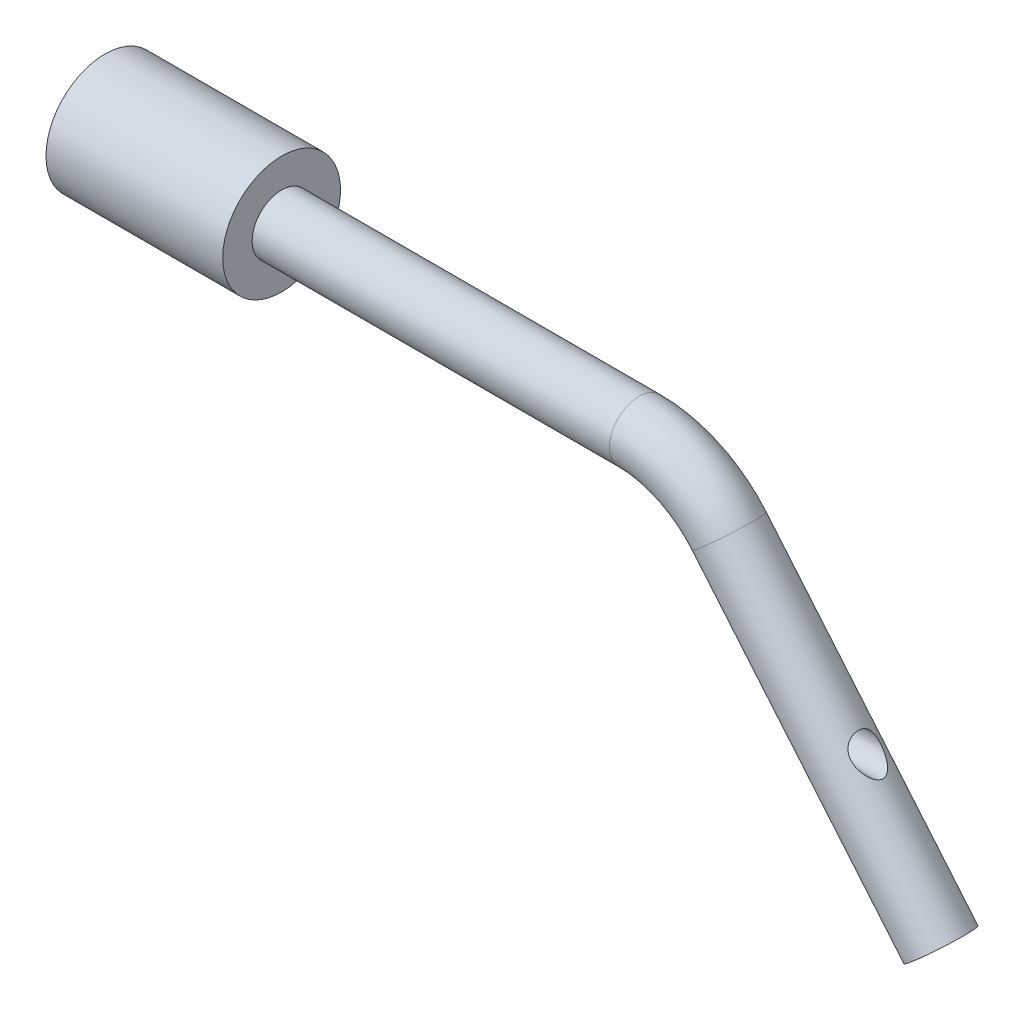
from build123d import *

# Parameters (mm, degrees)
PRUREZ_R                 = 5
SKICA3_R                 = 10
P_IDAT_VYSUNUT_M1_DEPTH  = 30
SKICA4_R                 = 2.5
ODEBRAT_VYSUNUT_M1_DEPTH = 156.515429595


with BuildPart() as part:
    # Táhnout po křivce1: sweep along a path in Draha
    with BuildLine(Plane.XY) as t_hnout_po_k_ivce1_path:
        Line((0, 0), (90.673846837, 0))
        ThreePointArc((90.673846837, 0), (99.126212072, -1.873844259), (105.994735699, -7.144247806))
        Line((105.994735699, -7.144247806), (141.954981559, -50))
    # Prurez → Táhnout po křivce1 (sweep)
    with BuildSketch(Plane(origin=(0, 0, 0), x_dir=(0, 0, -1), z_dir=(1, 0, 0))):
        Circle(PRUREZ_R)
    sweep(path=t_hnout_po_k_ivce1_path.line)

    # Skica3 → Přidat vysunutím1 (add)
    with BuildSketch(Plane.ZY):
        Circle(SKICA3_R)
    extrude(amount=-P_IDAT_VYSUNUT_M1_DEPTH)

    # Skica4 → Odebrat vysunutím1 (cut, through all)
    with BuildSketch(Plane.ZY):
        with Locations((0, -28)):
            Circle(SKICA4_R)
    extrude(amount=-ODEBRAT_VYSUNUT_M1_DEPTH, mode=Mode.SUBTRACT)


solid = part.part
